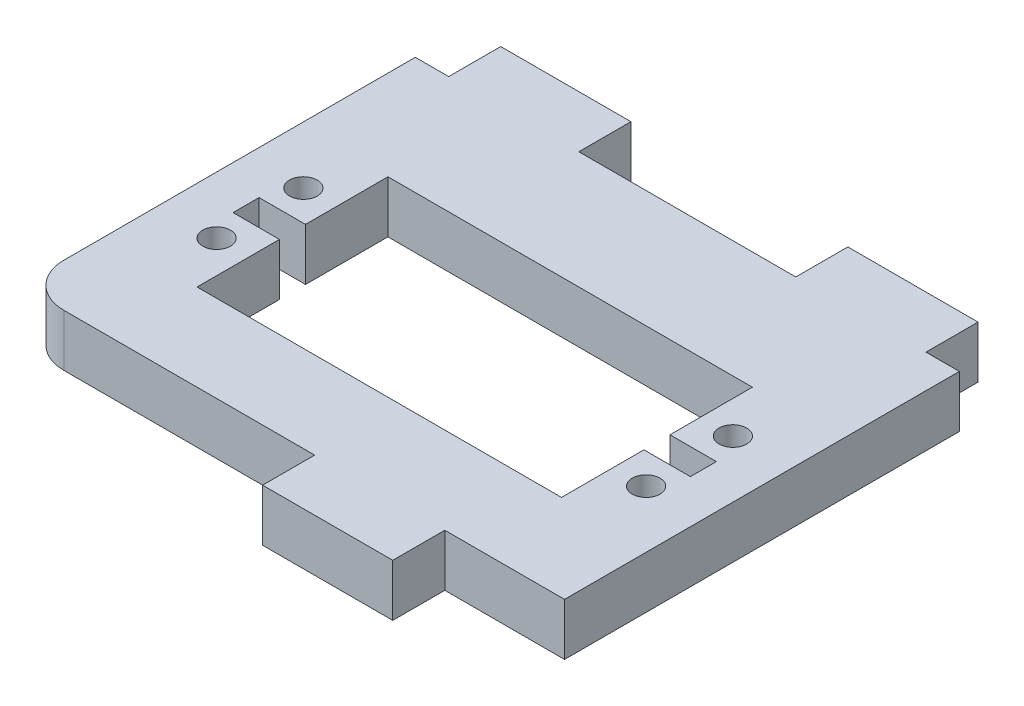
from build123d import *

# Parameters (mm, degrees)
ESBO_O1_R                = 1.6
RESSALTO_EXTRUS_O1_DEPTH = 6


with BuildPart() as part:
    # Esboço1 → Ressalto-extrusão1 (new body)
    with BuildSketch(Plane.XZ.offset(6)):
        with BuildLine():
            Line((2.55259, 21), (-26.35, 21))
            ThreePointArc((-26.35, 21), (-29.885533906, 19.535533906), (-31.35, 16))
            Line((-31.35, 16), (-31.35, -24.5))
            Line((-31.35, -24.5), (-27.5, -24.5))
            Line((-27.5, -24.5), (-27.5, -30.5))
            Line((-27.5, -30.5), (-12.5, -30.5))
            Line((-12.5, -30.5), (-12.5, -24.5))
            Line((-12.5, -24.5), (12.5, -24.5))
            Line((12.5, -24.5), (12.5, -30.5))
            Line((12.5, -30.5), (27.5, -30.5))
            Line((27.5, -30.5), (27.5, -24.5))
            Line((27.5, -24.5), (31.35, -24.5))
            Line((31.35, -24.5), (31.35, 21))
            Line((31.35, 21), (17.55259, 21))
            Line((17.55259, 21), (17.55259, 27))
            Line((17.55259, 27), (2.55259, 27))
            Line((2.55259, 27), (2.55259, 21))
        make_face()
        with Locations(Location((24.75, 5, 0), (0, 0, 90))):
            Circle(ESBO_O1_R, mode=Mode.SUBTRACT)
        with Locations(Location((24.75, -5, 0), (0, 0, 90))):
            Circle(ESBO_O1_R, mode=Mode.SUBTRACT)
        with Locations(Location((-24.75, 5, 0), (0, 0, 90))):
            Circle(ESBO_O1_R, mode=Mode.SUBTRACT)
        with Locations(Location((-24.75, -5, 0), (0, 0, 90))):
            Circle(ESBO_O1_R, mode=Mode.SUBTRACT)
        Polygon((-26.35, 1.5), (-21, 1.5), (-21, 11), (21, 11), (21, 1.5), (26.35, 1.5), (26.35, -1.5), (21, -1.5), (21, -11), (-21, -11), (-21, -1.5), (-26.35, -1.5), align=None, mode=Mode.SUBTRACT)
    extrude(amount=-RESSALTO_EXTRUS_O1_DEPTH)


solid = part.part
